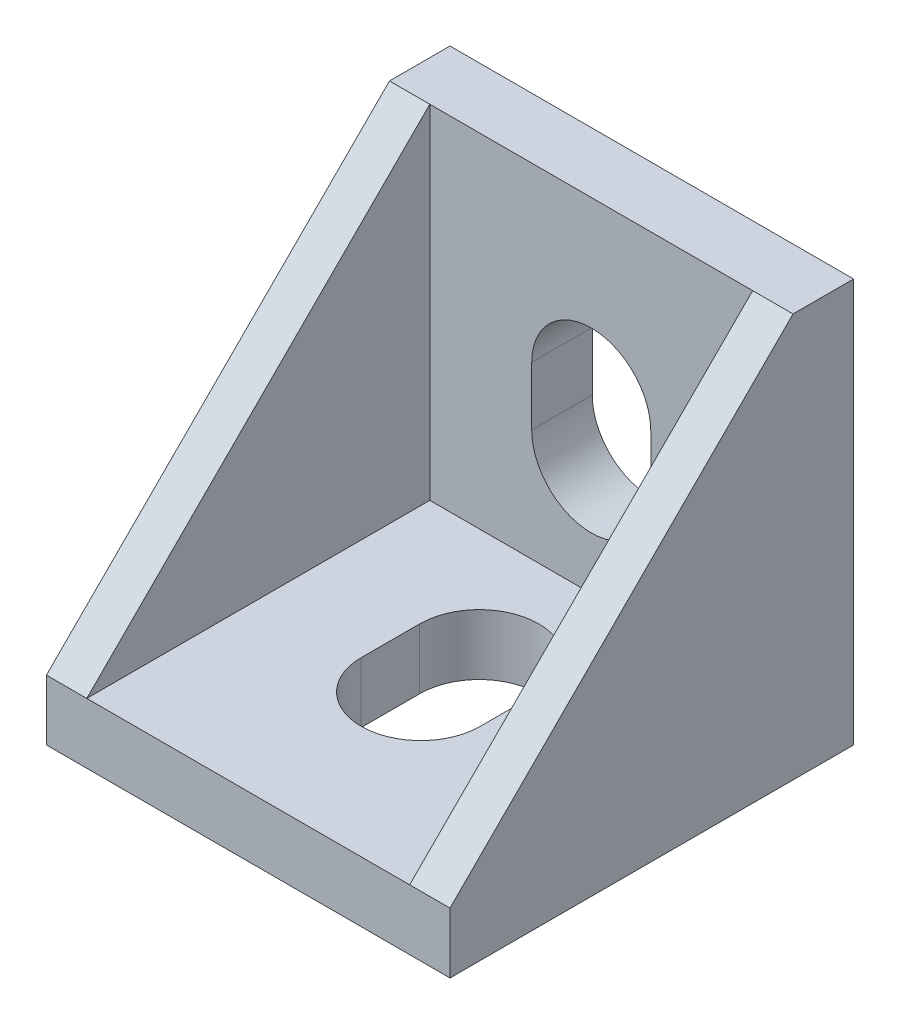
from build123d import *

# Parameters (mm, degrees)
SKETCH1_W           = 20
SKETCH1_H           = 20
BOSS_EXTRUDE1_DEPTH = 3
SKETCH2_W           = 20
SKETCH2_H           = 20
BOSS_EXTRUDE2_DEPTH = 3
BOSS_EXTRUDE3_DEPTH = 2
BOSS_EXTRUDE4_DEPTH = 2


with BuildPart() as part:
    # Sketch1 → Boss-Extrude1 (new body)
    with BuildSketch(Plane(origin=(0, 0, 0), x_dir=(1, 0, 0), z_dir=(0, 1, 0))):
        Rectangle(SKETCH1_W, SKETCH1_H)
        with BuildLine():
            Line((-2.95, -1.45), (-2.95, 1.45))
            ThreePointArc((-2.95, 1.45), (0, 4.4), (2.95, 1.45))
            Line((2.95, 1.45), (2.95, -1.45))
            ThreePointArc((2.95, -1.45), (0, -4.4), (-2.95, -1.45))
        make_face(mode=Mode.SUBTRACT)
    extrude(amount=BOSS_EXTRUDE1_DEPTH)

    # Sketch2 → Boss-Extrude2 (add)
    with BuildSketch(Plane(origin=(0, 0, -10), x_dir=(-1, 0, 0), z_dir=(0, 0, -1))):
        with Locations((0, 10)):
            Rectangle(SKETCH2_W, SKETCH2_H)
        with BuildLine():
            Line((-2.95, 8.55), (-2.95, 11.45))
            ThreePointArc((-2.95, 11.45), (0, 14.4), (2.95, 11.45))
            Line((2.95, 11.45), (2.95, 8.55))
            ThreePointArc((2.95, 8.55), (0, 5.6), (-2.95, 8.55))
        make_face(mode=Mode.SUBTRACT)
    extrude(amount=-BOSS_EXTRUDE2_DEPTH)

    # Sketch3 → Boss-Extrude3 (add)
    with BuildSketch(Plane(origin=(10, 0, 0), x_dir=(0, 0, -1), z_dir=(1, 0, 0))):
        Polygon((7, 20), (-10, 3), (7, 3), align=None)
    extrude(amount=-BOSS_EXTRUDE3_DEPTH)

    # Sketch4 → Boss-Extrude4 (add)
    with BuildSketch(Plane.ZY.offset(10)):
        Polygon((-7, 20), (-7, 3), (10, 3), align=None)
    extrude(amount=-BOSS_EXTRUDE4_DEPTH)


solid = part.part
